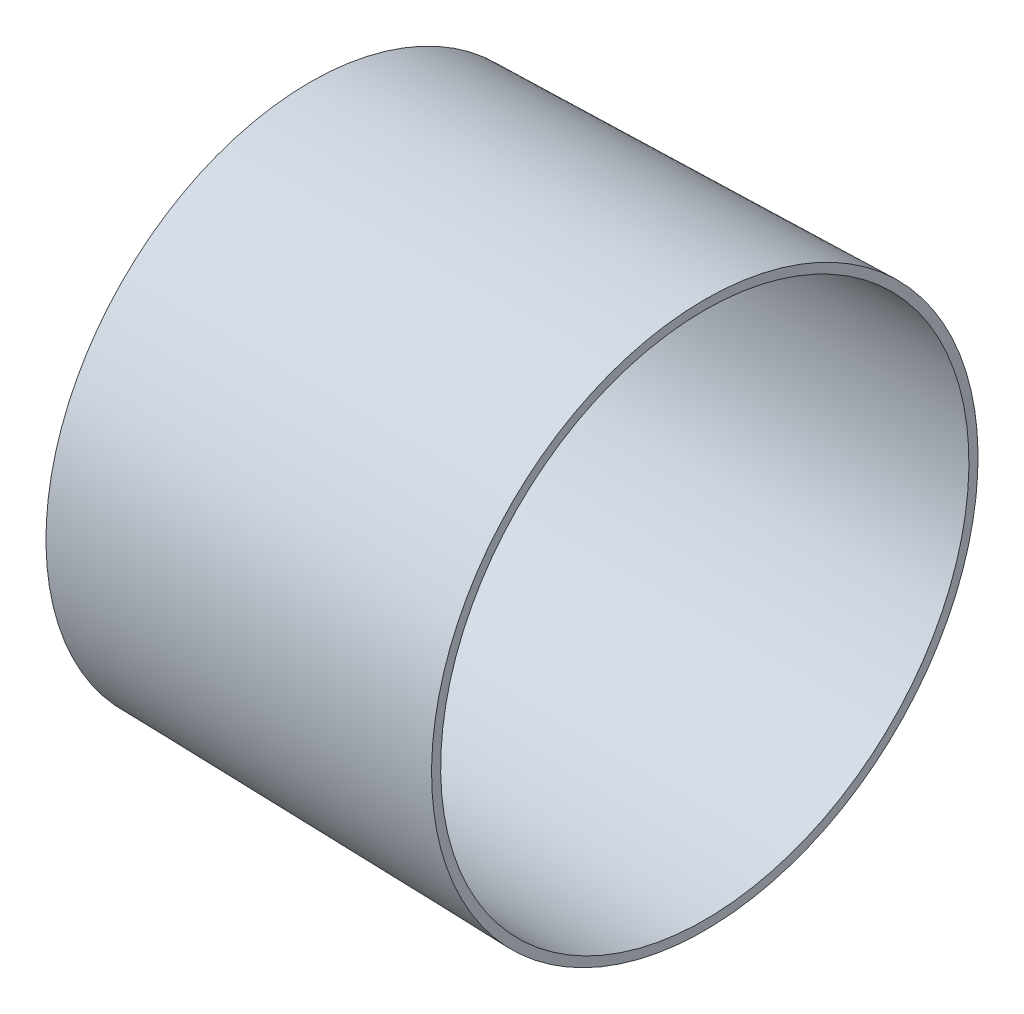
from build123d import *

# Parameters (mm, degrees)
REVOLVE1_ANGLE = 359.999999589


with BuildPart() as part:
    # Sketch1 → Revolve1 (revolve)
    with BuildSketch(Plane.XY):
        Polygon((3700, 420), (3700, 435), (4350, 450), (4350, 435), align=None)
    revolve(axis=Axis((0, 0, 0), (1, 0, 0)), revolution_arc=REVOLVE1_ANGLE)


solid = part.part
